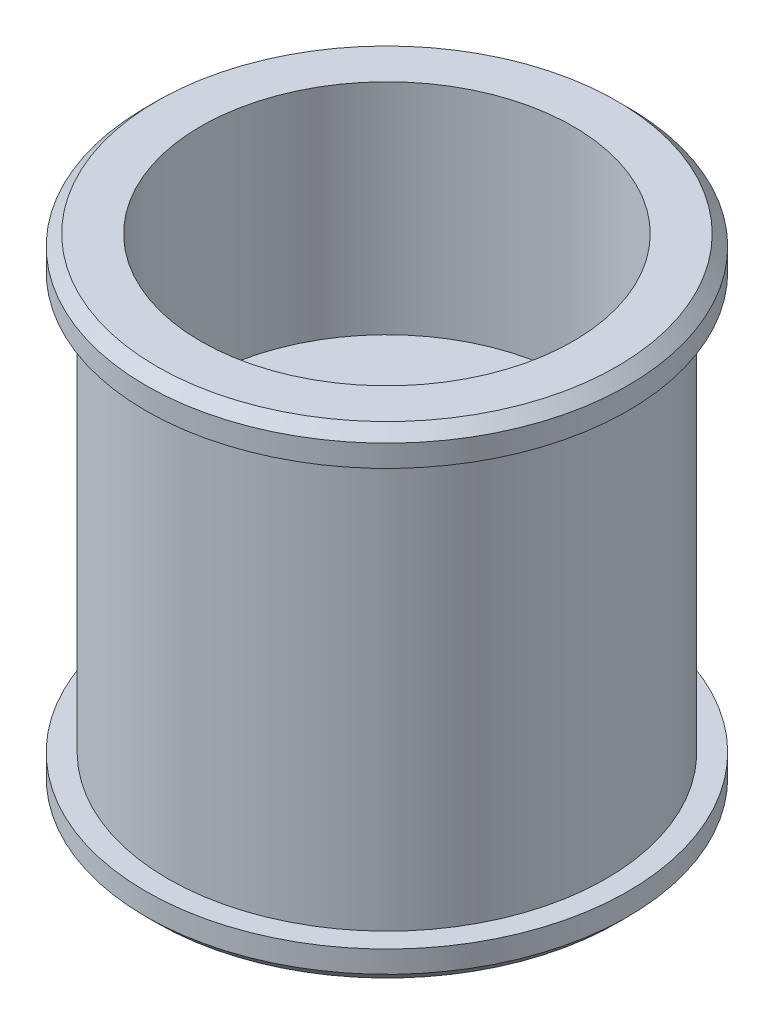
from build123d import *

# Parameters (mm, degrees)
SKETCH_1_R          = 11
SKETCH_1_R_2        = 1.5
EXTRUDE_1_DEPTH     = 22
CUT_EXTRUDE_START   = -1.5
SKETCH_2_R          = 12.5
SKETCH_2_R_2        = 10
CUT_EXTRUDE_1_DEPTH = 19
SKETCH_3_R          = 1
CUT_EXTRUDE_2_DEPTH = 18
CHAMFER_1_SIZE      = 0.5
CHAMFER_2_SIZE      = 0.5
SKETCH_4_R          = 8.5
CUT_EXTRUDE_3_DEPTH = 10


with BuildPart() as part:
    # Эскиз1 → Бобышка-Вытянуть1 (new body)
    with BuildSketch(Plane(origin=(0, 0, 0), x_dir=(1, 0, 0), z_dir=(0, 1, 0))):
        with Locations(Location((0, 0, 0), (0, 0, 270))):
            Circle(SKETCH_1_R)
        with Locations(Location((0, 0, 0), (0, 0, 270))):
            Circle(SKETCH_1_R_2, mode=Mode.SUBTRACT)
    extrude(amount=EXTRUDE_1_DEPTH)

    # Эскиз2 → Вырез-Вытянуть1 (cut)
    with BuildSketch(Plane(origin=(0, 22, 0), x_dir=(1, 0, 0), z_dir=(0, 1, 0)).offset(CUT_EXTRUDE_START)):
        Circle(SKETCH_2_R)
        with Locations(Location((0, 0, 0), (0, 0, 270))):
            Circle(SKETCH_2_R_2, mode=Mode.SUBTRACT)
    extrude(amount=-CUT_EXTRUDE_1_DEPTH, mode=Mode.SUBTRACT)

    # Эскиз3 → Вырез-Вытянуть2 (cut)
    with BuildSketch(Plane(origin=(0, 0, 0), x_dir=(0, 0, -1), z_dir=(1, 0, 0))):
        with Locations((0, 4.529870325)):
            Circle(SKETCH_3_R)
    extrude(amount=-CUT_EXTRUDE_2_DEPTH, mode=Mode.SUBTRACT)

    # Фаска1
    chamfer_1_edges = [part.edges().sort_by_distance(p)[0] for p in [
        (0, 0, -11),
    ]]
    chamfer(chamfer_1_edges, length=CHAMFER_1_SIZE)

    # Фаска2
    chamfer_2_edges = [part.edges().sort_by_distance(p)[0] for p in [
        (0, 22, -11),
    ]]
    chamfer(chamfer_2_edges, length=CHAMFER_2_SIZE)

    # Эскиз4 → Вырез-Вытянуть3 (cut)
    with BuildSketch(Plane(origin=(0, 22, 0), x_dir=(1, 0, 0), z_dir=(0, 1, 0))):
        with Locations(Location((0, 0, 0), (0, 0, 270))):
            Circle(SKETCH_4_R)
    extrude(amount=-CUT_EXTRUDE_3_DEPTH, mode=Mode.SUBTRACT)


solid = part.part
